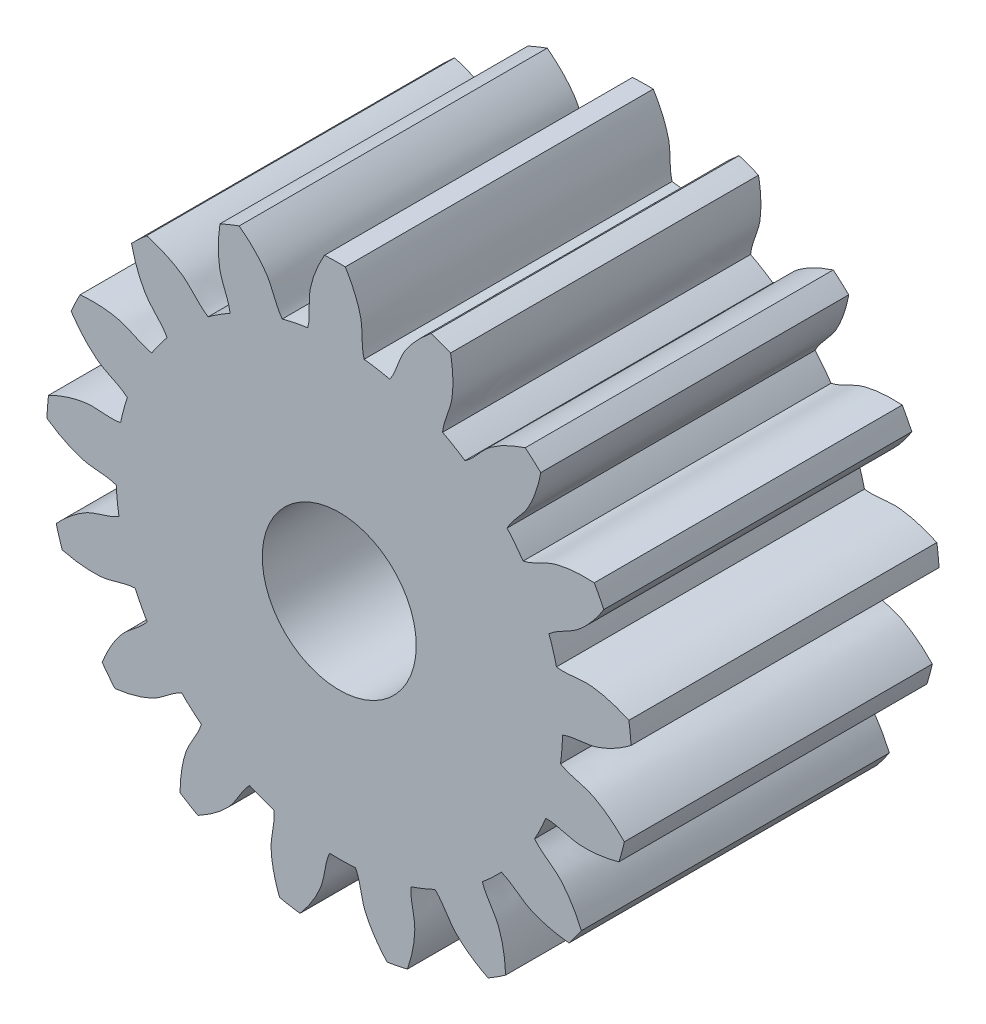
from build123d import *

# Parameters (mm, degrees)
SKETCH_1_R               = 14.5
SKETCH_1_R_2             = 5
EXTRUDE_1_DEPTH          = 20
EXTRUDE_2_DEPTH          = 20
PATTERN_CIRCULAR_1_COUNT = 17


with BuildPart() as part:
    # 草图1 → 凸台-拉伸1 (new body)
    with BuildSketch(Plane.XY):
        Circle(SKETCH_1_R)
        Circle(SKETCH_1_R_2, mode=Mode.SUBTRACT)
    extrude(amount=EXTRUDE_1_DEPTH)

    # 草图2 → 凸台-拉伸2 (add)
    with BuildSketch(Plane.XY):
        with BuildLine():
            ThreePointArc((18.806655179, 2.703649565), (18.890720164, 2.03486896), (18.951010344, 1.363527383))
            add(Edge.make_bspline(
                [(18.951010344, 1.363527383), (18.579465593, 1.085770146), (18.003875464, 0.708041748), (17.192919935, 0.321555176), (16.120776534, -0.081994227), (15.160225066, -0.021582845), (14.497356765, -0.27685164)],
                knots=[0, 0, 0, 0, 0.289468221, 0.427045393, 0.559833587, 1, 1, 1, 1], degree=3))
            ThreePointArc((14.497356765, -0.27685164), (14.41660223, 1.552926312), (14.105826015, 3.357926807))
            add(Edge.make_bspline(
                [(18.806655179, 2.703649565), (18.384481205, 2.895909076), (17.741652343, 3.142391923), (16.866992209, 3.347307493), (15.733502102, 3.513270657), (14.807851296, 3.249681501), (14.105826015, 3.357926807)],
                knots=[0, 0, 0, 0, 0.289468221, 0.427045393, 0.559833587, 1, 1, 1, 1], degree=3))
        make_face()
    extrude_2 = extrude(amount=EXTRUDE_2_DEPTH)

    # 阵列(圆周)1: 凸台-拉伸2 ×17 about axis
    pattern_circular_1_axis = Axis((0, 0, 20), (0, 0, -1))
    for i in range(1, PATTERN_CIRCULAR_1_COUNT):
        add(extrude_2.rotate(pattern_circular_1_axis, i * 360 / PATTERN_CIRCULAR_1_COUNT))


solid = part.part
